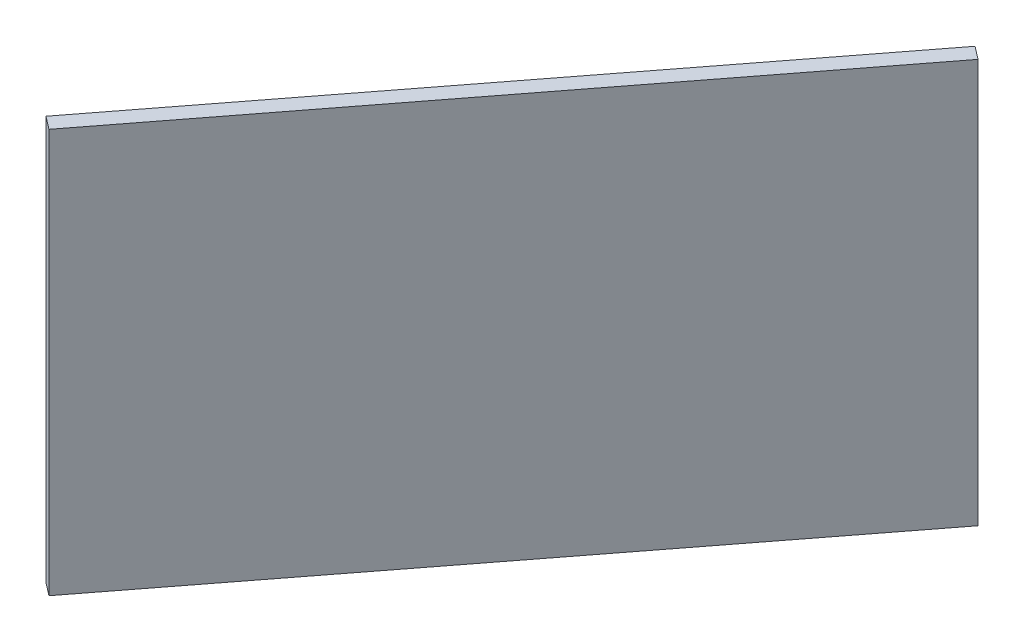
from build123d import *

# Parameters (mm, degrees)
BOSS_EXTRUDE1_DEPTH = 50


with BuildPart() as part:
    # Sketch1 → Boss-Extrude1 (new body)
    with BuildSketch(Plane(origin=(0, 0, 0), x_dir=(1, 0, 0), z_dir=(0, 1, 0))):
        Polygon((-0.792623989, -64.390289239), (49.207376011, 0.609710761), (50.792623989, -0.609710761), (0.792623989, -65.609710761), align=None)
    extrude(amount=BOSS_EXTRUDE1_DEPTH)


solid = part.part
